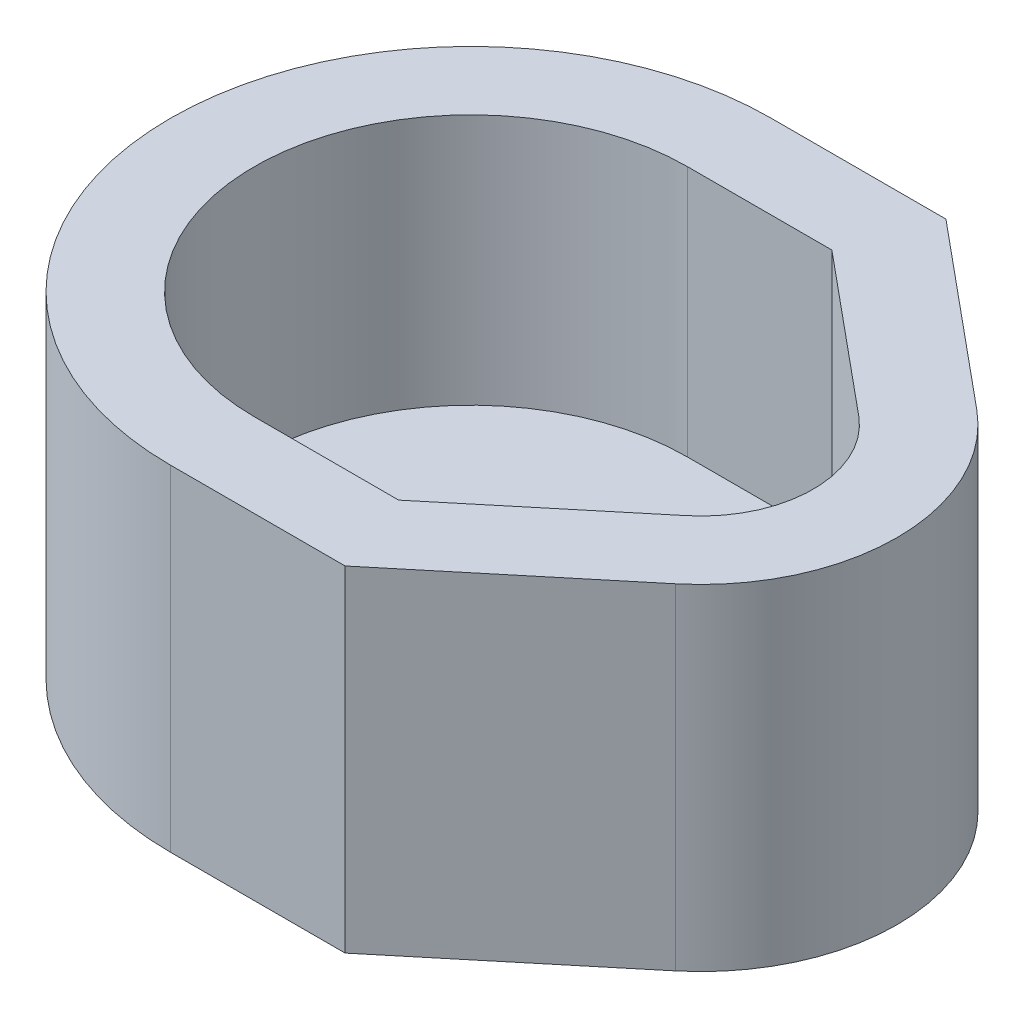
from build123d import *

# Parameters (mm, degrees)
BOSS_EXTRUDE1_DEPTH = 25.4
SHELL1_T            = -6.35
SKETCH2_R           = 3.98145
SKETCH2_R_2         = 3.1877
CUT_EXTRUDE1_DEPTH  = 59.965239742


with BuildPart() as part:
    # Sketch1 → Boss-Extrude1 (new body)
    with BuildSketch(Plane(origin=(0, 0, 0), x_dir=(1, 0, 0), z_dir=(0, 1, 0))):
        with BuildLine():
            Line((13.2334, 0), (26.921911775, 11.34881606))
            ThreePointArc((26.921911775, 11.34881606), (32.2834, 22.7584), (26.921911775, 34.16798394))
            Line((26.921911775, 34.16798394), (13.2334, 45.5168))
            Line((13.2334, 45.5168), (0, 45.5168))
            ThreePointArc((0, 45.5168), (-22.7584, 22.7584), (0, 0))
            Line((0, 0), (13.2334, 0))
        make_face()
    extrude(amount=BOSS_EXTRUDE1_DEPTH)

    # Shell1
    shell1_openings = [part.faces().sort_by_distance(p)[0] for p in [
        (3.880100933, 25.4, -22.7584),
    ]]
    offset(amount=SHELL1_T, openings=shell1_openings, kind=Kind.INTERSECTION)

    # Sketch2 → Cut-Extrude1 (cut, through all)
    with BuildSketch(Plane(origin=(0, 6.35, 0), x_dir=(1, 0, 0), z_dir=(0, 1, 0))):
        with Locations(Location((0, 22.7584, 0), (0, 0, 270))):
            Circle(SKETCH2_R)
        with Locations(Location((17.4625, 22.7584, 0), (0, 0, 270))):
            Circle(SKETCH2_R_2)
    extrude(amount=-CUT_EXTRUDE1_DEPTH, mode=Mode.SUBTRACT)


solid = part.part
